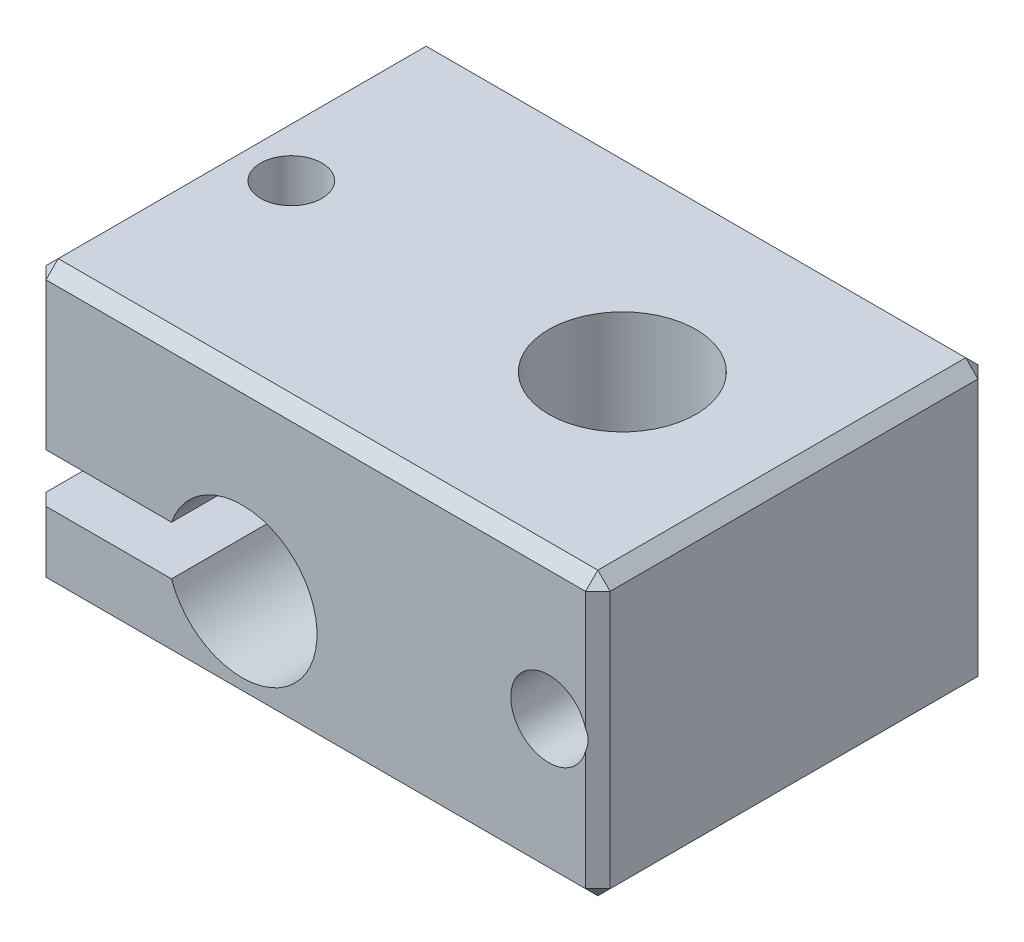
from build123d import *

# Parameters (mm, degrees)
BOSS_EXTRUDE1_DEPTH        = 8
CHAMFER1_SIZE              = 0.5
M3X0_5_TAPPED_HOLE2_D      = 2.5
M6X1_0_TAPPED_HOLE1_D      = 6
F_3_1_3_1_DIAMETER_HOLE1_D = 3.1
M3X0_5_TAPPED_HOLE3_REACH  = 20.125
M3X0_5_TAPPED_HOLE3_BORE_R = 1.25


with BuildPart() as part:
    # Sketch1 → Boss-Extrude1 (new, symmetric)
    with BuildSketch(Plane.XY):
        with BuildLine():
            Line((-11.5, -0.75), (-5.881405907, -0.75))
            ThreePointArc((-5.881405907, -0.75), (0.05, -1.75), (-5.881405907, -2.75))
            Line((-5.881405907, -2.75), (-11.5, -2.75))
            Line((-11.5, -2.75), (-11.5, -5.75))
            Line((-11.5, -5.75), (11.5, -5.75))
            Line((11.5, -5.75), (11.5, 5.75))
            Line((11.5, 5.75), (-11.5, 5.75))
            Line((-11.5, 5.75), (-11.5, -0.75))
        make_face()
    extrude(amount=BOSS_EXTRUDE1_DEPTH, both=True)

    # Chamfer1
    chamfer1_edges = [part.edges().sort_by_distance(p)[0] for p in [
        (-11.5, 2.5, 8),
        (0, 5.75, -8),
        (11.5, 0, -8),
        (11.5, -5.75, 0),
        (-11.5, -5.75, 0),
        (-11.5, 5.75, 0),
        (11.5, 5.75, 0),
        (-11.5, -4.25, 8),
        (0, -5.75, 8),
        (11.5, 0, 8),
        (0, 5.75, 8),
        (0, -5.75, -8),
        (-11.5, -4.25, -8),
        (-11.5, 2.5, -8),
    ]]
    chamfer(chamfer1_edges, length=CHAMFER1_SIZE)

    # M3x0.5 Tapped Hole2 (through all)
    with Locations(Plane(origin=(0, 5.75, 0), x_dir=(1, 0, 0), z_dir=(0, 1, 0))):
        with Locations((-9, 0)):
            Hole(M3X0_5_TAPPED_HOLE2_D / 2)

    # M6x1.0 Tapped Hole1 (through all)
    with Locations(Plane(origin=(0, 5.75, 0), x_dir=(1, 0, 0), z_dir=(0, 1, 0))):
        with Locations((4.5, 0)):
            Hole(M6X1_0_TAPPED_HOLE1_D / 2)

    # Ø3.1 (3.1) Diameter Hole1 (through all)
    with Locations(Plane.XY.offset(8)):
        with Locations((9.5, 0)):
            Hole(F_3_1_3_1_DIAMETER_HOLE1_D / 2)

    # M3x0.5 Tapped Hole3 bore → M3x0.5 Tapped Hole3 (cut, up to next)
    with BuildSketch(Plane(origin=(0, -5.75, 0), x_dir=(-1, 0, 0), z_dir=(0, -1, 0)), mode=Mode.PRIVATE) as m3x0_5_tapped_hole3_sk1:
        with Locations((-9.5, 0)):
            Circle(M3X0_5_TAPPED_HOLE3_BORE_R)
    m3x0_5_tapped_hole3_tool1 = extrude(m3x0_5_tapped_hole3_sk1.sketch, amount=-M3X0_5_TAPPED_HOLE3_REACH, mode=Mode.PRIVATE) & part.part
    add(m3x0_5_tapped_hole3_tool1.solids().sort_by_distance((9.5, -5.75, 0))[0], mode=Mode.SUBTRACT)


solid = part.part
